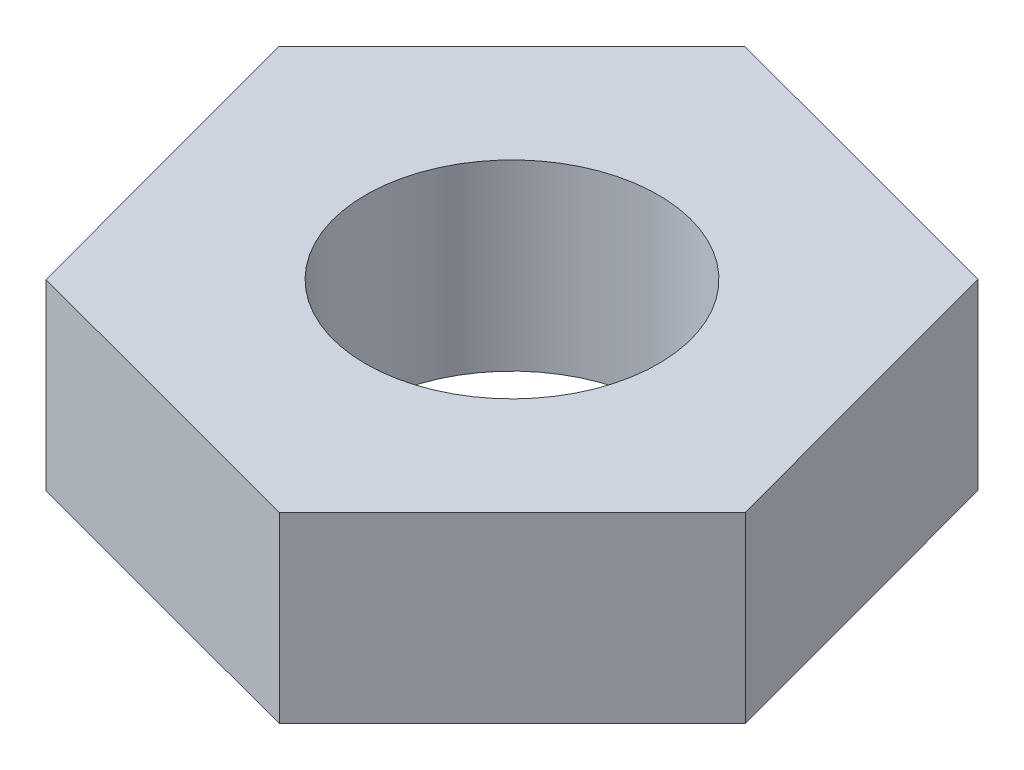
from build123d import *

# Parameters (mm, degrees)
ESQUISSE1_R        = 2
BOSS_EXTRU_1_DEPTH = 2.5


with BuildPart() as part:
    # Esquisse1 → Boss.-Extru.1 (new body)
    with BuildSketch(Plane(origin=(0, 0, 0), x_dir=(1, 0, 0), z_dir=(0, 1, 0))):
        Polygon((-4.350764255, 1.1622609), (-3.181929593, -3.18674192), (1.168834662, -4.349002821), (4.350764255, -1.1622609), (3.181929593, 3.18674192), (-1.168834662, 4.349002821), align=None)
        with Locations(Location((0, 0, 0), (0, 0, 270))):
            Circle(ESQUISSE1_R, mode=Mode.SUBTRACT)
    extrude(amount=BOSS_EXTRU_1_DEPTH)


solid = part.part
